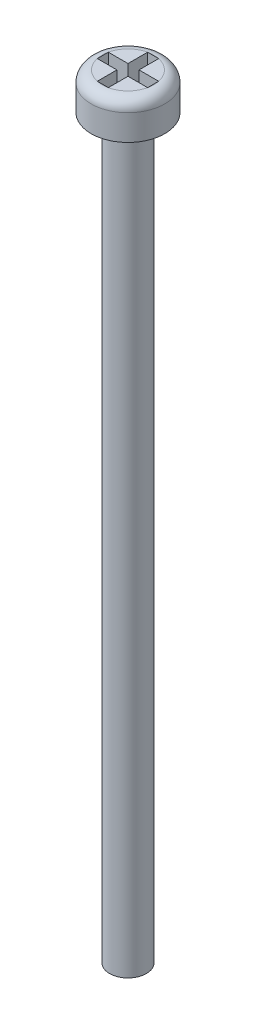
from build123d import *

# Parameters (mm, degrees)
BOSS_EXTRUDE1_DEPTH      = 10
BOSS_EXTRUDE1_DEPTH_BACK = 11
SKETCH1_R                = 0.5
SKETCH2_R                = 1
BOSS_EXTRUDE2_DEPTH      = 1
FILLET1_R                = 0.3
CUT_EXTRUDE1_DEPTH       = 0.6


with BuildPart() as part:
    # Sketch1 → Boss-Extrude1 (new, two sides: drawn at the far end of the back side and taken through both)
    with BuildSketch(Plane(origin=(0, 0, 0), x_dir=(1, 0, 0), z_dir=(0, 1, 0)).offset(-BOSS_EXTRUDE1_DEPTH_BACK)):
        with Locations(Location((0, 0, 0), (0, 0, 270))):
            Circle(SKETCH1_R)
    extrude(amount=BOSS_EXTRUDE1_DEPTH + BOSS_EXTRUDE1_DEPTH_BACK)

    # Sketch2 → Boss-Extrude2 (add)
    with BuildSketch(Plane(origin=(0, 10, 0), x_dir=(1, 0, 0), z_dir=(0, 1, 0))):
        with Locations(Location((0, 0, 0), (0, 0, 270))):
            Circle(SKETCH2_R)
    extrude(amount=-BOSS_EXTRUDE2_DEPTH)

    # Fillet1
    fillet1_edges = [part.edges().sort_by_distance(p)[0] for p in [
        (0, 10, -1),
    ]]
    fillet(fillet1_edges, radius=FILLET1_R)

    # Sketch3 → Cut-Extrude1 (cut)
    with BuildSketch(Plane(origin=(0, 10, 0), x_dir=(1, 0, 0), z_dir=(0, 1, 0))):
        Polygon((-0.15, 0.15), (-0.15, 0.683739717), (0.15, 0.683739717), (0.15, 0.15), (0.683739717, 0.15), (0.683739717, -0.15), (0.15, -0.15), (0.15, -0.683739717), (-0.15, -0.683739717), (-0.15, -0.15), (-0.683739717, -0.15), (-0.683739717, 0.15), align=None)
    extrude(amount=-CUT_EXTRUDE1_DEPTH, mode=Mode.SUBTRACT)


solid = part.part
